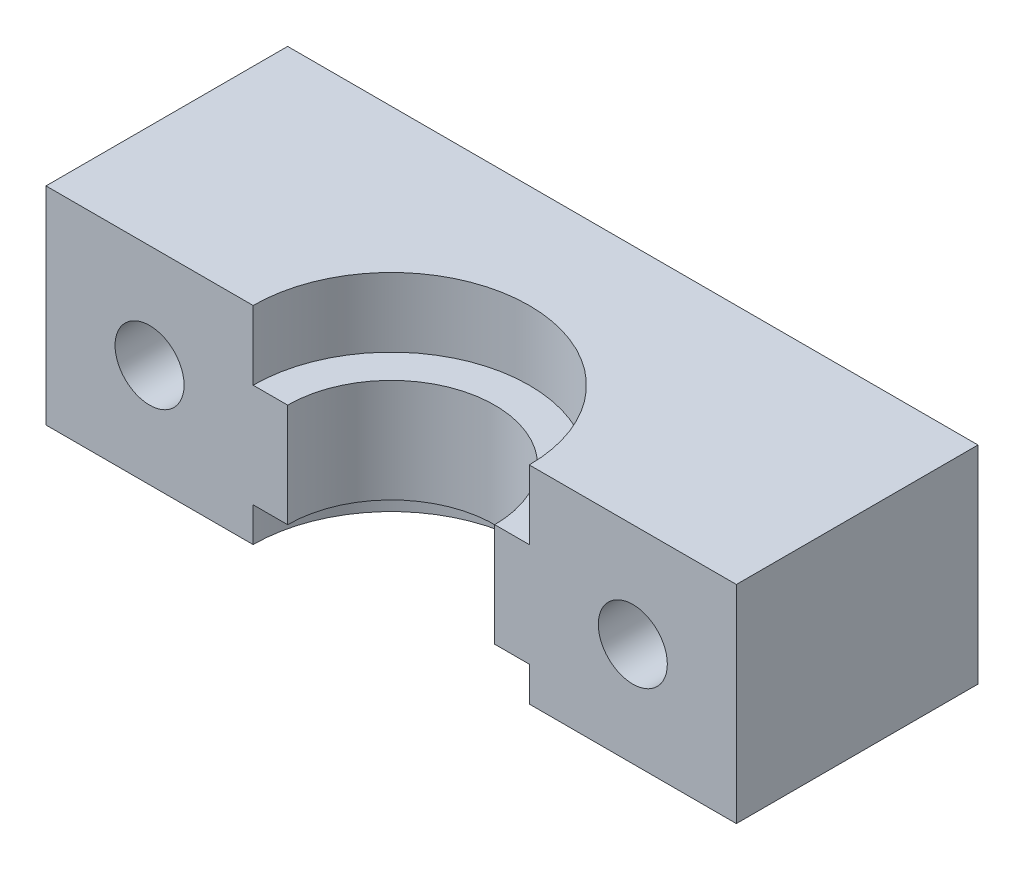
from build123d import *

# Parameters (mm, degrees)
SKETCH1_W           = 40
SKETCH1_H           = 12
SKETCH1_R           = 2
BOSS_EXTRUDE1_DEPTH = 14
SKETCH2_R           = 3.5
CUT_EXTRUDE1_DEPTH  = 5


with BuildPart() as part:
    # Sketch1 → Boss-Extrude1 (new body)
    with BuildSketch(Plane.XY):
        with Locations((27.119550003, 16.407464025)):
            Rectangle(SKETCH1_W, SKETCH1_H)
        with Locations((13.119550003, 16.407464025)):
            Circle(SKETCH1_R, mode=Mode.SUBTRACT)
        with Locations((41.119550003, 16.407464025)):
            Circle(SKETCH1_R, mode=Mode.SUBTRACT)
    extrude(amount=BOSS_EXTRUDE1_DEPTH)

    # Sketch2 → Cut-Extrude1 (cut)
    with BuildSketch(Plane.XY):
        with Locations((13.119550003, 16.407464025)):
            Circle(SKETCH2_R)
        with Locations((41.119550003, 16.407464025)):
            Circle(SKETCH2_R)
    extrude(amount=CUT_EXTRUDE1_DEPTH, mode=Mode.SUBTRACT)

    # Sketch3 → Cut-Revolve1 (revolve, cut)
    with BuildSketch(Plane.XY.offset(14)):
        Polygon((35.119550003, 22.407464025), (35.119550003, 18.407464025), (33.119550003, 18.407464025), (33.119550003, 12.407464025), (35.119550003, 12.407464025), (35.119550003, 10.407464025), (27.119550003, 10.407464025), (27.119550003, 22.407464025), align=None)
    revolve(axis=Axis((27.119550003, 22.407464025, 14), (0, -1, 0)), mode=Mode.SUBTRACT)


solid = part.part
